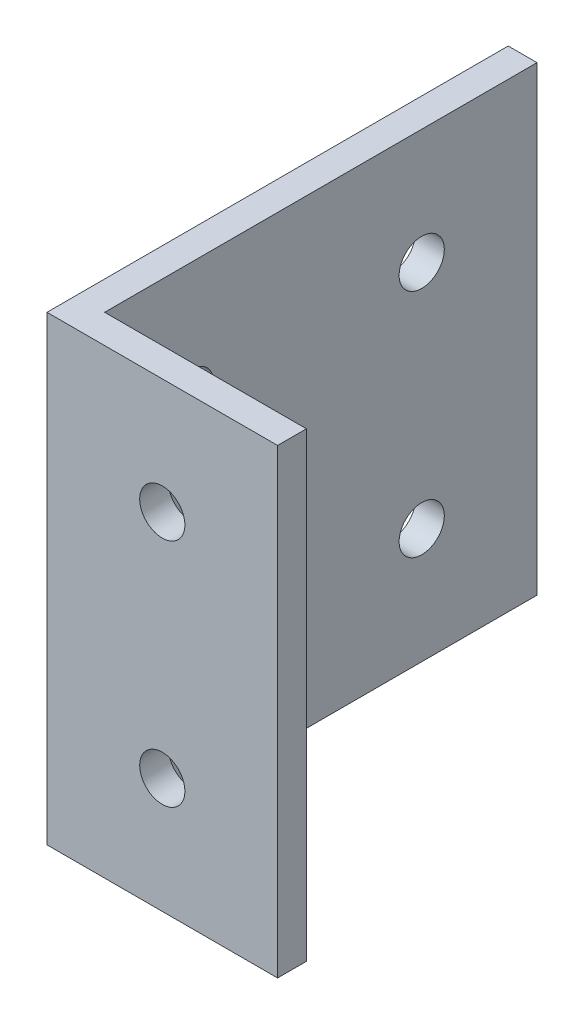
from build123d import *

# Parameters (mm, degrees)
BOSS_EXTRUDE1_DEPTH = 50.8
SKETCH2_R           = 2.4892
CUT_EXTRUDE1_DEPTH  = 76.201267443
SKETCH3_R           = 2.4892
CUT_EXTRUDE2_DEPTH  = 75.121121315


with BuildPart() as part:
    # Sketch1 → Boss-Extrude1 (new body)
    with BuildSketch(Plane(origin=(0, 0, 0), x_dir=(1, 0, 0), z_dir=(0, 1, 0))):
        Polygon((0, 0), (0, 50.8), (3.175, 50.8), (3.175, 3.175), (25.4, 3.175), (25.4, 0), align=None)
    extrude(amount=BOSS_EXTRUDE1_DEPTH)

    # Sketch2 → Cut-Extrude1 (cut, through all)
    with BuildSketch(Plane(origin=(3.175, 0, 0), x_dir=(0, 0, -1), z_dir=(1, 0, 0))):
        with Locations((38.1, 38.1)):
            Circle(SKETCH2_R)
        with Locations((38.1, 12.7)):
            Circle(SKETCH2_R)
        with Locations((12.7, 12.7)):
            Circle(SKETCH2_R)
        with Locations((12.7, 38.1)):
            Circle(SKETCH2_R)
    extrude(amount=-CUT_EXTRUDE1_DEPTH, mode=Mode.SUBTRACT)

    # Sketch3 → Cut-Extrude2 (cut, through all)
    with BuildSketch(Plane(origin=(0, 0, -3.175), x_dir=(-1, 0, 0), z_dir=(0, 0, -1))):
        with Locations((-12.7, 38.1)):
            Circle(SKETCH3_R)
        with Locations((-12.7, 12.7)):
            Circle(SKETCH3_R)
    extrude(amount=-CUT_EXTRUDE2_DEPTH, mode=Mode.SUBTRACT)


solid = part.part
